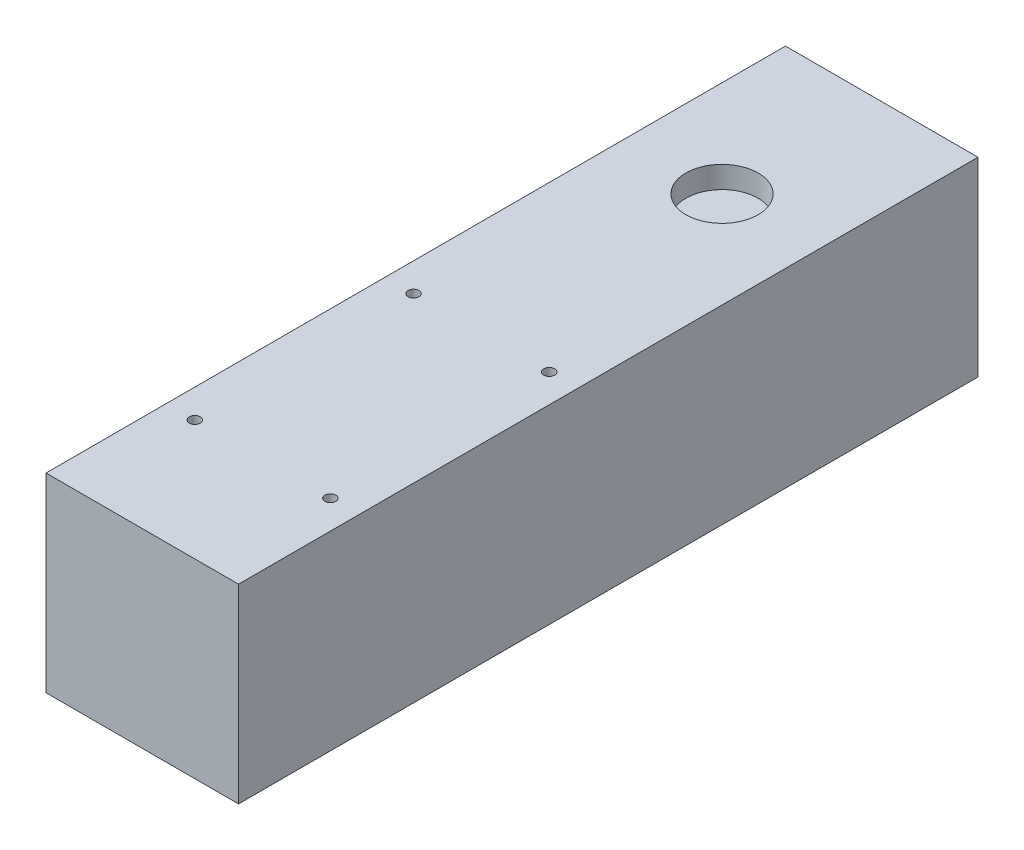
from build123d import *

# Parameters (mm, degrees)
SKETCH_1_W                  = 88
SKETCH_1_H                  = 338
EXTRUDE_1_DEPTH             = 87
SKETCH_2_R                  = 2.5
CUT_EXTRUDE_1_DEPTH         = 196.105099882
PATTERN_LINEAR_1_COUNT      = 2
PATTERN_LINEAR_1_PITCH      = 100
PATTERN_LINEAR_1_COUNT_DIR2 = 2
PATTERN_LINEAR_1_PITCH_DIR2 = 62
SKETCH_3_R                  = 16.524250602
CUT_EXTRUDE_2_DEPTH         = 10


with BuildPart() as part:
    # 草图1 → 凸台-拉伸1 (new body)
    with BuildSketch(Plane(origin=(0, 0, 0), x_dir=(1, 0, 0), z_dir=(0, 1, 0))):
        Rectangle(SKETCH_1_W, SKETCH_1_H)
    extrude(amount=EXTRUDE_1_DEPTH)

    # 草图2 → 切除-拉伸1 (cut, through all)
    with BuildSketch(Plane.XZ):
        with Locations(Location((31, 114, 0), (0, 0, 270))):
            Circle(SKETCH_2_R)
    cut_extrude_1 = extrude(amount=-CUT_EXTRUDE_1_DEPTH, mode=Mode.SUBTRACT)

    # 阵列(线性)1: Cut-Extrude 1 2 × 2
    with Locations(*[(-j * PATTERN_LINEAR_1_PITCH_DIR2, 0, -i * PATTERN_LINEAR_1_PITCH) for i in range(PATTERN_LINEAR_1_COUNT) for j in range(PATTERN_LINEAR_1_COUNT_DIR2) if (i, j) != (0, 0)]):
        add(cut_extrude_1, mode=Mode.SUBTRACT)

    # 草图3 → 切除-拉伸2 (cut)
    with BuildSketch(Plane(origin=(0, 87, 0), x_dir=(1, 0, 0), z_dir=(0, 1, 0))):
        with Locations(Location((0, 96, 0), (0, 0, 270))):
            Circle(SKETCH_3_R)
    extrude(amount=-CUT_EXTRUDE_2_DEPTH, mode=Mode.SUBTRACT)


solid = part.part
